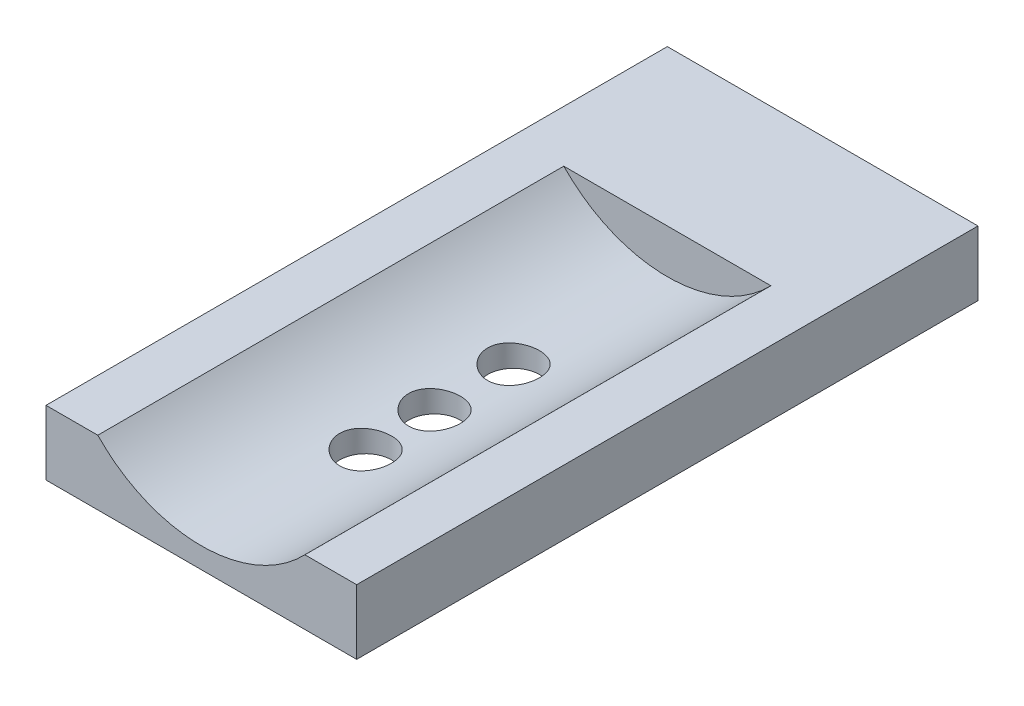
from build123d import *

# Parameters (mm, degrees)
SKETCH1_W               = 60
SKETCH1_H               = 6.25
BOSS_EXTRUDE1_DEPTH     = 30
CUT_EXTRUDE1_DEPTH      = 68.372564891
CUT_EXTRUDE1_DEPTH_BACK = 45
SKETCH4_R               = 2.5
SKETCH4_W               = 15.6
SKETCH4_H               = 10.5
CUT_EXTRUDE2_DEPTH      = 4
CUT_EXTRUDE3_DEPTH      = 3.9


with BuildPart() as part:
    # Sketch1 → Boss-Extrude1 (new body)
    with BuildSketch(Plane(origin=(0, 0, 0), x_dir=(0, 0, -1), z_dir=(1, 0, 0))):
        with Locations((30, 3.125)):
            Rectangle(SKETCH1_W, SKETCH1_H)
    extrude(amount=BOSS_EXTRUDE1_DEPTH)

    # Sketch2 → Cut-Extrude1 (cut, two sides: drawn at the far end of the back side and taken through both)
    with BuildSketch(Plane.XY.offset(-CUT_EXTRUDE1_DEPTH_BACK)):
        with BuildLine():
            Line((5, 6.25), (25, 6.25))
            ThreePointArc((25, 6.25), (15, 2), (5, 6.25))
        make_face()
    extrude(amount=CUT_EXTRUDE1_DEPTH + CUT_EXTRUDE1_DEPTH_BACK, mode=Mode.SUBTRACT)

    # Sketch4 → Cut-Extrude2 (cut)
    with BuildSketch(Plane.XZ):
        with Locations(Location((15, -15.87, 0), (0, 0, 270))):
            Circle(SKETCH4_R)
        with Locations(Location((15, -22.52, 0), (0, 0, 270))):
            Circle(SKETCH4_R)
        with Locations(Location((15, -30.15, 0), (0, 0, 270))):
            Circle(SKETCH4_R)
        with Locations((15, -50.85)):
            Rectangle(SKETCH4_W, SKETCH4_H)
    extrude(amount=-CUT_EXTRUDE2_DEPTH, mode=Mode.SUBTRACT)

    # Sketch5 → Cut-Extrude3 (cut)
    with BuildSketch(Plane(origin=(0, 0, -60), x_dir=(-1, 0, 0), z_dir=(0, 0, -1))):
        Polygon((-10, 1.25), (-20, 1.25), (-18.5, 2.75), (-20, 4.25), (-10, 4.25), align=None)
    extrude(amount=-CUT_EXTRUDE3_DEPTH, mode=Mode.SUBTRACT)


solid = part.part
